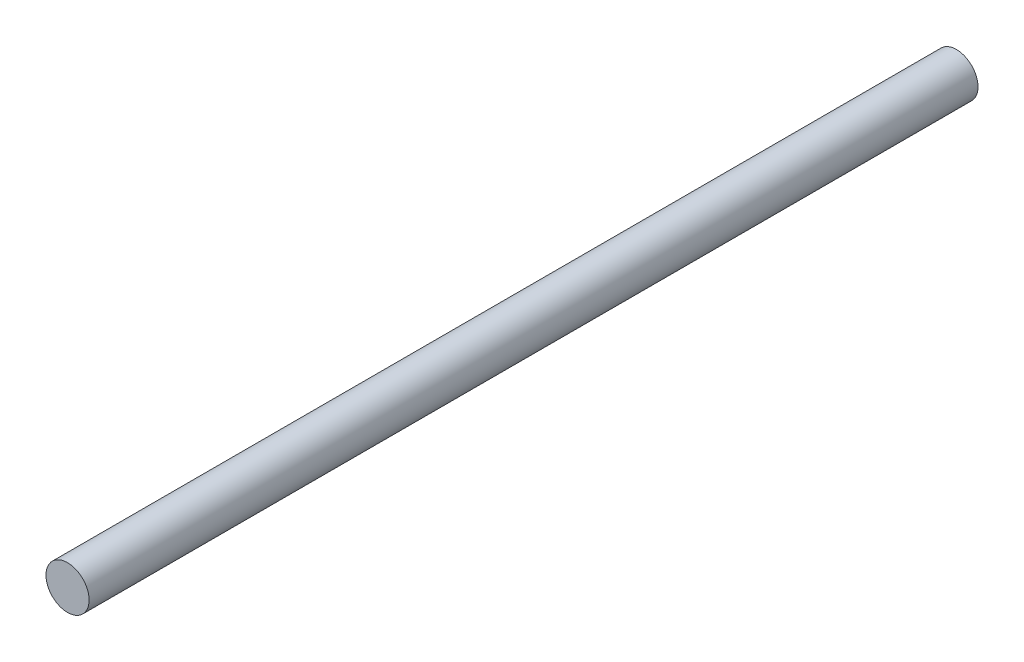
from build123d import *

# Parameters (mm, degrees)
SKETCH1_R           = 2.5
BOSS_EXTRUDE1_DEPTH = 103


with BuildPart() as part:
    # Sketch1 → Boss-Extrude1 (new body)
    with BuildSketch(Plane.XY):
        Circle(SKETCH1_R)
    extrude(amount=BOSS_EXTRUDE1_DEPTH)


solid = part.part
